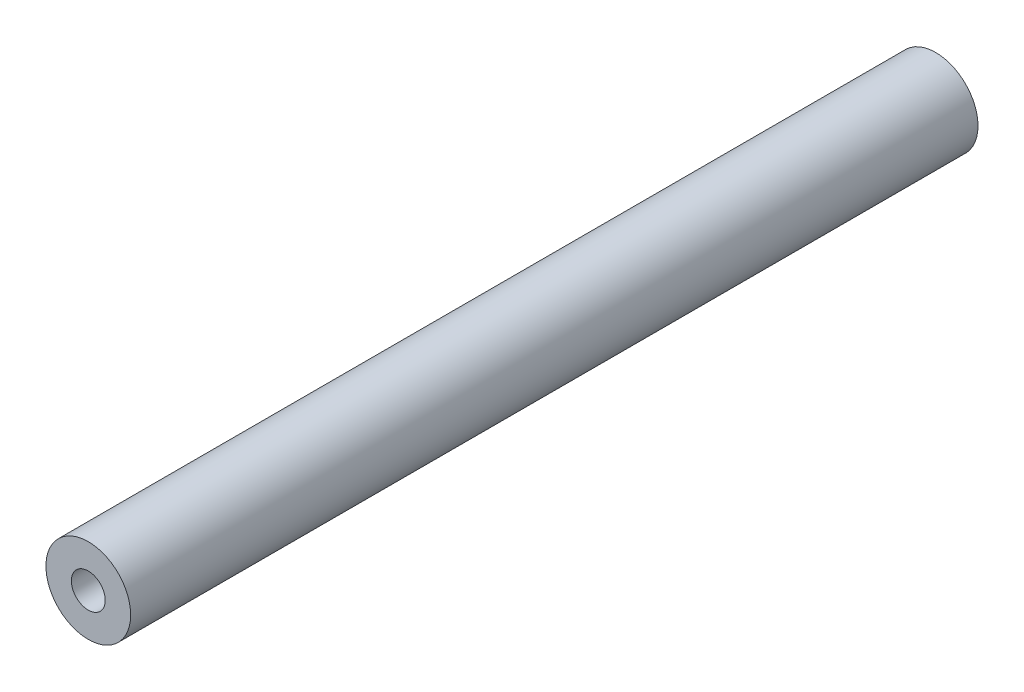
from build123d import *

# Parameters (mm, degrees)
SKETCH_1_R      = 3
SKETCH_1_R_2    = 1.2
EXTRUDE_1_DEPTH = 60


with BuildPart() as part:
    # 草圖1 → 伸長-薄件1 (new body)
    with BuildSketch(Plane.XY):
        Circle(SKETCH_1_R)
        Circle(SKETCH_1_R_2, mode=Mode.SUBTRACT)
    extrude(amount=EXTRUDE_1_DEPTH)


solid = part.part
